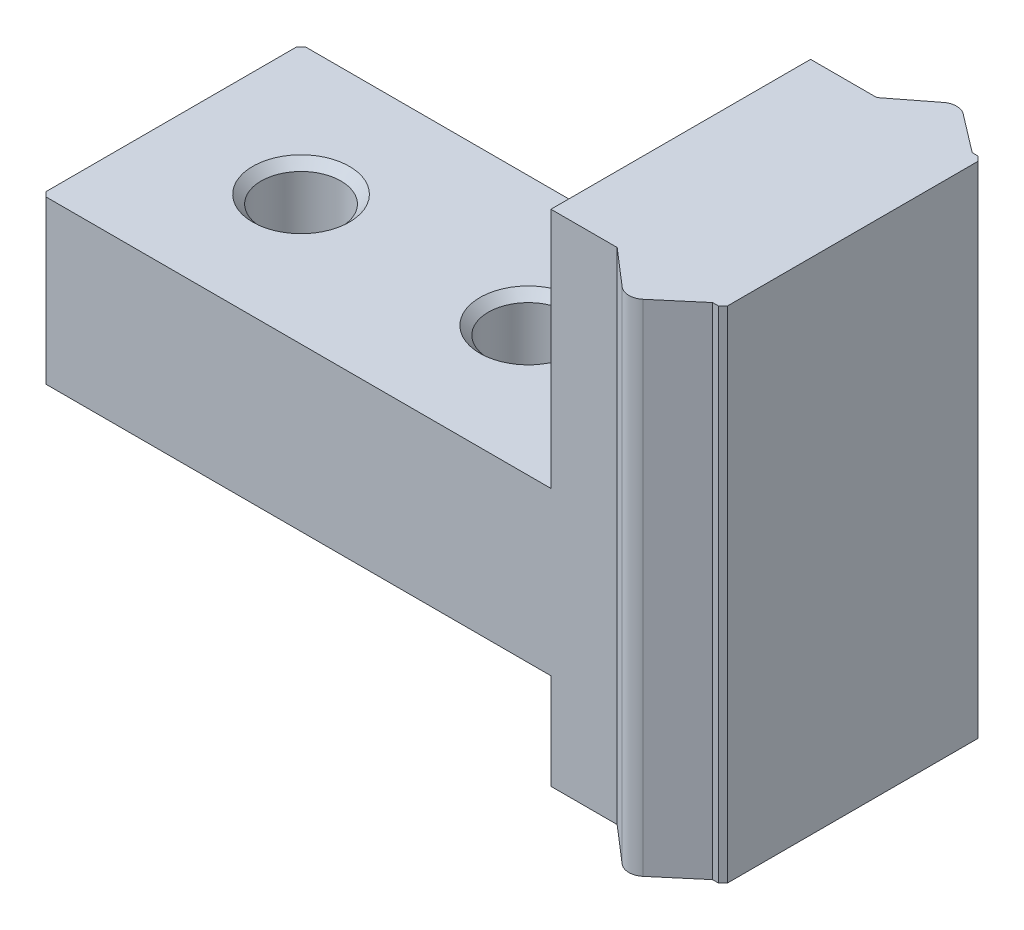
from build123d import *

# Parameters (mm, degrees)
BOSS_EXTRUDE1_DEPTH = 15.4
BOSS_EXTRUDE2_DEPTH = 5
SCALE_1_SCALE       = 2.5


with BuildPart() as part:
    # Sketch1 → Boss-Extrude1 (new body)
    with BuildSketch(Plane(origin=(0, -3, 0), x_dir=(1, 0, 0), z_dir=(0, 1, 0))):
        with BuildLine():
            Line((-51.8, -4), (-49.76, -4))
            Line((-49.76, -4), (-48.626761605, -4.978453238))
            ThreePointArc((-48.626761605, -4.978453238), (-48.302157504, -5.099995345), (-47.97651659, -4.981259077))
            Line((-47.97651659, -4.981259077), (-46.82, -4))
            Line((-46.82, -4), (-46.641421356, -4))
            Line((-46.641421356, -4), (-46.5, -3.858578644))
            Line((-46.5, -3.858578644), (-46.5, 3.858578644))
            Line((-46.5, 3.858578644), (-46.641421356, 4))
            Line((-46.641421356, 4), (-46.82, 4))
            Line((-46.82, 4), (-47.996771021, 4.897557777))
            ThreePointArc((-47.996771021, 4.897557777), (-48.302073982, 4.999995699), (-48.606516627, 4.895028552))
            Line((-48.606516627, 4.895028552), (-49.76, 4))
            Line((-49.76, 4), (-51.8, 4))
            Line((-51.8, 4), (-51.8, -4))
        make_face()
    extrude(amount=-BOSS_EXTRUDE1_DEPTH)

    # Sketch2 → Boss-Extrude2 (add)
    with BuildSketch(Plane(origin=(0, -10.45, 0), x_dir=(1, 0, 0), z_dir=(0, 1, 0))):
        Polygon((-67.5, 3.858578644), (-67.5, -3.858578644), (-67.358578644, -4), (-51.8, -4), (-51.8, 4), (-67.358578644, 4), align=None)
    extrude(amount=-BOSS_EXTRUDE2_DEPTH)

    # Sketch3 → Cut-Revolve1 (revolve, cut)
    with BuildSketch(Plane.XY):
        Polygon((-63.5, -15.45), (-65, -15.45), (-64.7295, -15.1795), (-64.7295, -10.7105), (-65, -10.44), (-63.5, -10.44), align=None)
    revolve(axis=Axis((-63.5, -10.44, 0), (0, -1, 0)), mode=Mode.SUBTRACT)

    # Sketch4 → Cut-Revolve2 (revolve, cut)
    with BuildSketch(Plane.XY):
        Polygon((-56.5, -15.45), (-58, -15.45), (-57.7295, -15.1795), (-57.7295, -10.7105), (-58, -10.44), (-56.5, -10.44), align=None)
    revolve(axis=Axis((-56.5, -10.44, 0), (0, -1, 0)), mode=Mode.SUBTRACT)


with BuildPart() as part_1:
    # 缩放比例1: scaled about (-53.834630524, -11.714177537, 0.010190259)
    add(part.part.scale(SCALE_1_SCALE).moved(Location((80.751945786, 17.571266306, -0.015285389))))


solid = part_1.part
